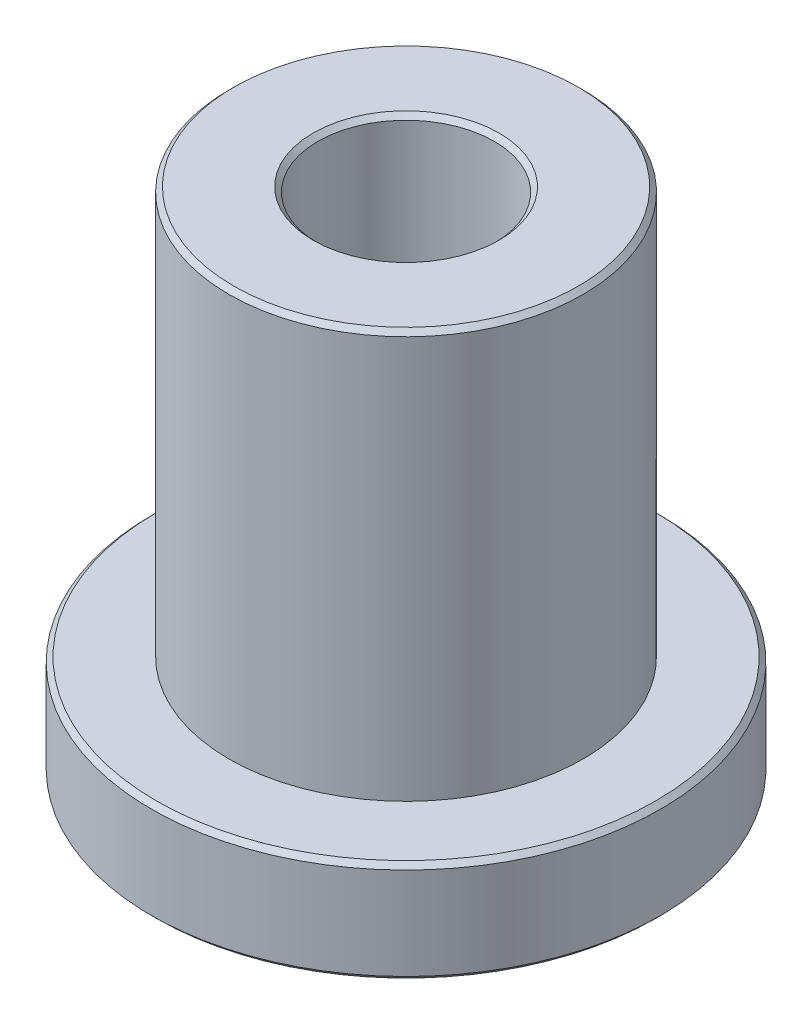
from build123d import *

# Parameters (mm, degrees)
SKETCH1_R           = 11.049
BOSS_EXTRUDE1_DEPTH = 25.4
SKETCH2_R           = 15.875
BOSS_EXTRUDE2_DEPTH = 6.35
SKETCH3_R           = 5.5
CUT_EXTRUDE1_DEPTH  = 39.885649667
CHAMFER1_SIZE       = 0.299999908


with BuildPart() as part:
    # Sketch1 → Boss-Extrude1 (new body)
    with BuildSketch(Plane(origin=(0, 0, 0), x_dir=(1, 0, 0), z_dir=(0, 1, 0))):
        with Locations(Location((0, 0, 0), (0, 0, 270))):
            Circle(SKETCH1_R)
    extrude(amount=BOSS_EXTRUDE1_DEPTH)

    # Sketch2 → Boss-Extrude2 (add)
    with BuildSketch(Plane.XZ):
        with Locations(Location((0, 0, 0), (0, 0, 270))):
            Circle(SKETCH2_R)
    extrude(amount=BOSS_EXTRUDE2_DEPTH)

    # Sketch3 → Cut-Extrude1 (cut, through all)
    with BuildSketch(Plane.XZ.offset(6.35)):
        with Locations(Location((0, 0, 0), (0, 0, 270))):
            Circle(SKETCH3_R)
    extrude(amount=-CUT_EXTRUDE1_DEPTH, mode=Mode.SUBTRACT)

    # Chamfer1
    chamfer1_edges = [part.edges().sort_by_distance(p)[0] for p in [
        (0, 25.4, 5.5),
        (0, -6.35, 5.5),
        (0, 25.4, -11.049),
        (0, 0, 15.875),
        (0, -6.35, 15.875),
    ]]
    chamfer(chamfer1_edges, length=CHAMFER1_SIZE)


solid = part.part
